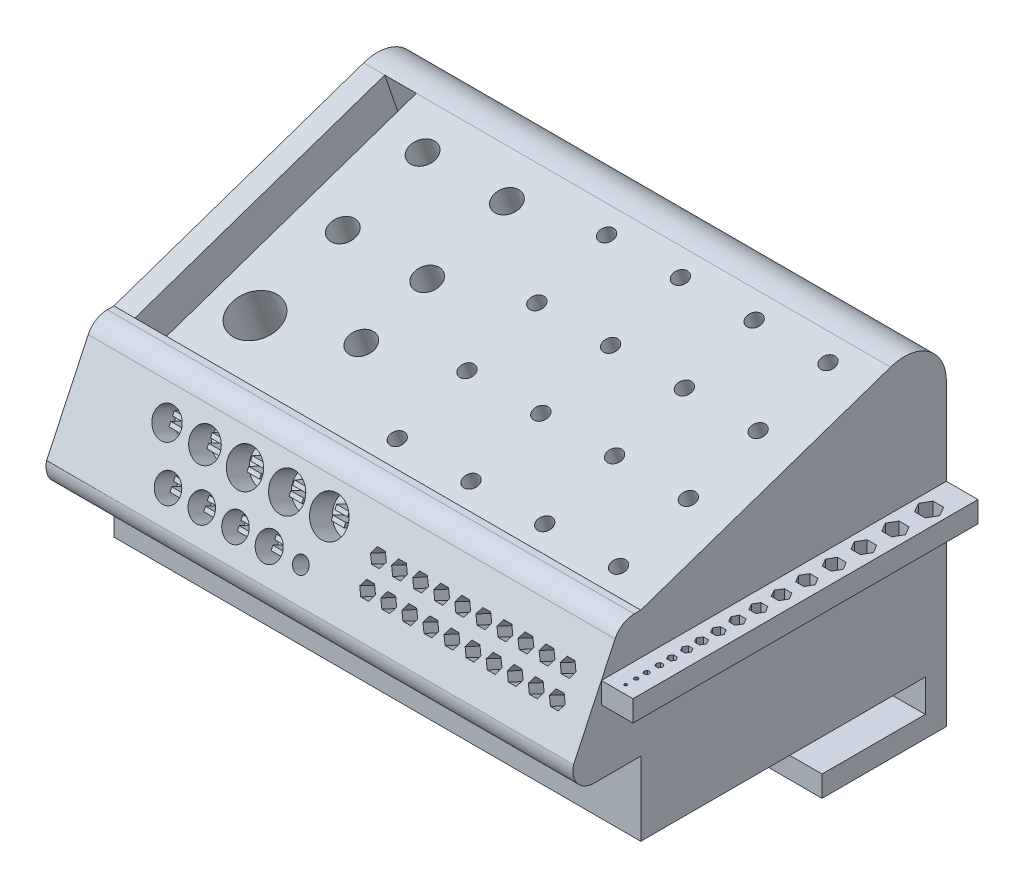
from build123d import *

# Parameters (mm, degrees)
BOSS_EXTRUDE1_DEPTH = 250
SKETCH2_R           = 3.5
CUT_EXTRUDE1_DEPTH  = 80
SKETCH3_R           = 6
SKETCH3_R_2         = 11
SKETCH3_W           = 15
SKETCH3_H           = 125.276618042
CUT_EXTRUDE3_DEPTH  = 80
SKETCH5_W           = 250
SKETCH5_H           = 60
BOSS_EXTRUDE3_DEPTH = 35
CUT_EXTRUDE4_DEPTH  = 339.389670995
CUT_EXTRUDE6_DEPTH  = 15
SKETCH9_R           = 8.625
SKETCH9_R_2         = 8.125
SKETCH9_R_3         = 7.125
SKETCH9_R_4         = 6.625
SKETCH9_R_5         = 6.125
SKETCH9_R_6         = 3.625
SKETCH9_R_7         = 6
CUT_EXTRUDE7_DEPTH  = 12
SKETCH10_W          = 6
SKETCH10_H          = 2
BOSS_EXTRUDE4_DEPTH = 6.25
SKETCH11_W          = 163.690314635
SKETCH11_H          = 10
BOSS_EXTRUDE5_DEPTH = 15
CUT_EXTRUDE8_DEPTH  = 330.146008669


with BuildPart() as part:
    # Sketch1 → Boss-Extrude1 (new body)
    with BuildSketch(Plane(origin=(0, 0, 0), x_dir=(0, 0, -1), z_dir=(1, 0, 0))):
        with BuildLine():
            Line((0, 0), (-49, 0))
            Line((-49, 0), (-49, -10))
            Line((-49, -10), (10, -10))
            Line((10, -10), (10, 132.011741113))
            ThreePointArc((10, 132.011741113), (1.627992291, 148.284104042), (-16.478979528, 150.933232182))
            Line((-16.478979528, 150.933232182), (-135, 110.35))
            Line((-135, 110.35), (-135, 15.35))
            Line((-135, 15.35), (0, 15.35))
            Line((0, 15.35), (0, 0))
        make_face()
    extrude(amount=BOSS_EXTRUDE1_DEPTH)

    # Sketch2 → Cut-Extrude1 (cut)
    with BuildSketch(Plane(origin=(0, 140.144330878, 47.987351918), x_dir=(1, 0, 0), z_dir=(0, 0.9460745534501107, 0.32394897640550396))):
        with Locations(Location((230, -81.972295169, 0), (0, 0, 270))):
            Circle(SKETCH2_R)
        with Locations(Location((230, -46.972295169, 0), (0, 0, 270))):
            Circle(SKETCH2_R)
        with Locations(Location((230, -11.972295169, 0), (0, 0, 270))):
            Circle(SKETCH2_R)
        with Locations(Location((230, 23.027704831, 0), (0, 0, 270))):
            Circle(SKETCH2_R)
        with Locations(Location((195, -81.972295169, 0), (0, 0, 270))):
            Circle(SKETCH2_R)
        with Locations(Location((195, -46.972295169, 0), (0, 0, 270))):
            Circle(SKETCH2_R)
        with Locations(Location((195, -11.972295169, 0), (0, 0, 270))):
            Circle(SKETCH2_R)
        with Locations(Location((195, 23.027704831, 0), (0, 0, 270))):
            Circle(SKETCH2_R)
        with Locations(Location((160, -81.972295169, 0), (0, 0, 270))):
            Circle(SKETCH2_R)
        with Locations(Location((160, -46.972295169, 0), (0, 0, 270))):
            Circle(SKETCH2_R)
        with Locations(Location((160, -11.972295169, 0), (0, 0, 270))):
            Circle(SKETCH2_R)
        with Locations(Location((160, 23.027704831, 0), (0, 0, 270))):
            Circle(SKETCH2_R)
        with Locations(Location((125, -81.972295169, 0), (0, 0, 270))):
            Circle(SKETCH2_R)
        with Locations(Location((125, -46.972295169, 0), (0, 0, 270))):
            Circle(SKETCH2_R)
        with Locations(Location((125, -11.972295169, 0), (0, 0, 270))):
            Circle(SKETCH2_R)
        with Locations(Location((125, 23.027704831, 0), (0, 0, 270))):
            Circle(SKETCH2_R)
    extrude(amount=-CUT_EXTRUDE1_DEPTH, mode=Mode.SUBTRACT)

    # Sketch3 → Cut-Extrude3 (cut)
    with BuildSketch(Plane(origin=(0, 140.144330878, 47.987351918), x_dir=(1, 0, 0), z_dir=(0, 0.9460745534501107, 0.32394897640550396))):
        with Locations(Location((85, 15.304322873, 0), (0, 0, 270))):
            Circle(SKETCH3_R)
        with Locations(Location((85, -24.695677127, 0), (0, 0, 270))):
            Circle(SKETCH3_R)
        with Locations(Location((85, -57.734559628, 0), (0, 0, 270))):
            Circle(SKETCH3_R)
        with Locations(Location((45, 15.304322873, 0), (0, 0, 270))):
            Circle(SKETCH3_R)
        with Locations(Location((45, -24.695677127, 0), (0, 0, 270))):
            Circle(SKETCH3_R)
        with Locations(Location((45, -68.745987147, 0), (0, 0, 270))):
            Circle(SKETCH3_R_2)
        with Locations((17.5, -29.333986148)):
            Rectangle(SKETCH3_W, SKETCH3_H)
    extrude(amount=-CUT_EXTRUDE3_DEPTH, mode=Mode.SUBTRACT)

    # Sketch5 → Boss-Extrude3 (add)
    with BuildSketch(Plane.XY.offset(135)):
        with Locations((125, 80.35)):
            Rectangle(SKETCH5_W, SKETCH5_H)
    extrude(amount=BOSS_EXTRUDE3_DEPTH)

    # Sketch6 → Cut-Extrude4 (cut, through all)
    with BuildSketch(Plane(origin=(250, 0, 0), x_dir=(0, 0, -1), z_dir=(1, 0, 0))):
        with BuildLine():
            Line((-170, 50.35), (-157.192235936, 50.35))
            ThreePointArc((-157.192235936, 50.35), (-165.074290316, 54.195877906), (-166.893660937, 62.77535625))
            Line((-166.893660937, 62.77535625), (-147.176252931, 104.613112241))
            ThreePointArc((-147.176252931, 104.613112241), (-143.486272945, 108.794854126), (-138.130487401, 110.35))
            Line((-138.130487401, 110.35), (-170, 110.35))
            Line((-170, 110.35), (-170, 50.35))
        make_face()
    extrude(amount=-CUT_EXTRUDE4_DEPTH, mode=Mode.SUBTRACT)

    # Sketch8 → Cut-Extrude6 (cut)
    with BuildSketch(Plane(origin=(0, 75.768264649, 160.770328793), x_dir=(1, 0, 0), z_dir=(0, 0.4263112240760583, 0.904576552994147))):
        Polygon((141.24722325, 14.765179927), (143.123611625, 11.515179927), (146.876388375, 11.515179927), (148.75277675, 14.765179927), (146.876388375, 18.015179927), (143.123611625, 18.015179927), align=None)
        Polygon((151.24722325, 14.765179927), (153.123611625, 11.515179927), (156.876388375, 11.515179927), (158.75277675, 14.765179927), (156.876388375, 18.015179927), (153.123611625, 18.015179927), align=None)
        Polygon((161.24722325, 14.765179927), (163.123611625, 11.515179927), (166.876388375, 11.515179927), (168.75277675, 14.765179927), (166.876388375, 18.015179927), (163.123611625, 18.015179927), align=None)
        Polygon((171.24722325, 14.765179927), (173.123611625, 11.515179927), (176.876388375, 11.515179927), (178.75277675, 14.765179927), (176.876388375, 18.015179927), (173.123611625, 18.015179927), align=None)
        Polygon((181.24722325, 14.765179927), (183.123611625, 11.515179927), (186.876388375, 11.515179927), (188.75277675, 14.765179927), (186.876388375, 18.015179927), (183.123611625, 18.015179927), align=None)
        Polygon((191.24722325, 14.765179927), (193.123611625, 11.515179927), (196.876388375, 11.515179927), (198.75277675, 14.765179927), (196.876388375, 18.015179927), (193.123611625, 18.015179927), align=None)
        Polygon((201.24722325, 14.765179927), (203.123611625, 11.515179927), (206.876388375, 11.515179927), (208.75277675, 14.765179927), (206.876388375, 18.015179927), (203.123611625, 18.015179927), align=None)
        Polygon((211.24722325, 14.765179927), (213.123611625, 11.515179927), (216.876388375, 11.515179927), (218.75277675, 14.765179927), (216.876388375, 18.015179927), (213.123611625, 18.015179927), align=None)
        Polygon((221.24722325, 14.765179927), (223.123611625, 11.515179927), (226.876388375, 11.515179927), (228.75277675, 14.765179927), (226.876388375, 18.015179927), (223.123611625, 18.015179927), align=None)
        Polygon((231.24722325, 14.765179927), (233.123611625, 11.515179927), (236.876388375, 11.515179927), (238.75277675, 14.765179927), (236.876388375, 18.015179927), (233.123611625, 18.015179927), align=None)
        Polygon((231.24722325, 2.765179927), (233.123611625, -0.484820073), (236.876388375, -0.484820073), (238.75277675, 2.765179927), (236.876388375, 6.015179927), (233.123611625, 6.015179927), align=None)
        Polygon((221.24722325, 2.765179927), (223.123611625, -0.484820073), (226.876388375, -0.484820073), (228.75277675, 2.765179927), (226.876388375, 6.015179927), (223.123611625, 6.015179927), align=None)
        Polygon((211.24722325, 2.765179927), (213.123611625, -0.484820073), (216.876388375, -0.484820073), (218.75277675, 2.765179927), (216.876388375, 6.015179927), (213.123611625, 6.015179927), align=None)
        Polygon((201.24722325, 2.765179927), (203.123611625, -0.484820073), (206.876388375, -0.484820073), (208.75277675, 2.765179927), (206.876388375, 6.015179927), (203.123611625, 6.015179927), align=None)
        Polygon((191.24722325, 2.765179927), (193.123611625, -0.484820073), (196.876388375, -0.484820073), (198.75277675, 2.765179927), (196.876388375, 6.015179927), (193.123611625, 6.015179927), align=None)
        Polygon((181.24722325, 2.765179927), (183.123611625, -0.484820073), (186.876388375, -0.484820073), (188.75277675, 2.765179927), (186.876388375, 6.015179927), (183.123611625, 6.015179927), align=None)
        Polygon((171.24722325, 2.765179927), (173.123611625, -0.484820073), (176.876388375, -0.484820073), (178.75277675, 2.765179927), (176.876388375, 6.015179927), (173.123611625, 6.015179927), align=None)
        Polygon((161.24722325, 2.765179927), (163.123611625, -0.484820073), (166.876388375, -0.484820073), (168.75277675, 2.765179927), (166.876388375, 6.015179927), (163.123611625, 6.015179927), align=None)
        Polygon((151.24722325, 2.765179927), (153.123611625, -0.484820073), (156.876388375, -0.484820073), (158.75277675, 2.765179927), (156.876388375, 6.015179927), (153.123611625, 6.015179927), align=None)
        Polygon((141.24722325, 2.765179927), (143.123611625, -0.484820073), (146.876388375, -0.484820073), (148.75277675, 2.765179927), (146.876388375, 6.015179927), (143.123611625, 6.015179927), align=None)
    extrude(amount=-CUT_EXTRUDE6_DEPTH, mode=Mode.SUBTRACT)

    # Sketch9 → Cut-Extrude7 (cut)
    with BuildSketch(Plane(origin=(0, 75.768264649, 160.770328793), x_dir=(1, 0, 0), z_dir=(0, 0.4263112240760583, 0.904576552994147))):
        with Locations(Location((120, 18.762077206, 0), (0, 0, 270))):
            Circle(SKETCH9_R)
        with Locations(Location((100, 18.762077206, 0), (0, 0, 270))):
            Circle(SKETCH9_R_2)
        with Locations(Location((80, 18.762077206, 0), (0, 0, 270))):
            Circle(SKETCH9_R_2)
        with Locations(Location((61, 18.762077206, 0), (0, 0, 270))):
            Circle(SKETCH9_R_3)
        with Locations(Location((43, 18.762077206, 0), (0, 0, 270))):
            Circle(SKETCH9_R_4)
        with Locations(Location((100, -1.237922794, 0), (0, 0, 270))):
            Circle(SKETCH9_R_5)
        with Locations(Location((115, -1.237922794, 0), (0, 0, 270))):
            Circle(SKETCH9_R_6)
        with Locations(Location((84, -1.237922794, 0), (0, 0, 270))):
            Circle(SKETCH9_R_7)
        with Locations(Location((68, -1.237922794, 0), (0, 0, 270))):
            Circle(SKETCH9_R_7)
        with Locations(Location((52, -1.237922794, 0), (0, 0, 270))):
            Circle(SKETCH9_R_7)
    extrude(amount=-CUT_EXTRUDE7_DEPTH, mode=Mode.SUBTRACT)

    # Sketch10 → Boss-Extrude4 (add)
    with BuildSketch(Plane(origin=(0, 70.65252996, 149.915410157), x_dir=(1, 0, 0), z_dir=(0, 0.4263112240760583, 0.904576552994147))):
        with Locations((100, 20.762077206)):
            Rectangle(SKETCH10_W, SKETCH10_H)
        with Locations((120, 20.762077206)):
            Rectangle(SKETCH10_W, SKETCH10_H)
        with Locations((120, 16.762077206)):
            Rectangle(SKETCH10_W, SKETCH10_H)
        with Locations((100, 16.762077206)):
            Rectangle(SKETCH10_W, SKETCH10_H)
        with Locations((80, 20.762077206)):
            Rectangle(SKETCH10_W, SKETCH10_H)
        with Locations((80, 16.762077206)):
            Rectangle(SKETCH10_W, SKETCH10_H)
        with Locations((61.000897675, 20.762077206)):
            Rectangle(SKETCH10_W, SKETCH10_H)
        with Locations((61, 16.762077206)):
            Rectangle(SKETCH10_W, SKETCH10_H)
        with Locations((43, 20.762077206)):
            Rectangle(SKETCH10_W, SKETCH10_H)
        with Locations((43, 16.762077206)):
            Rectangle(SKETCH10_W, SKETCH10_H)
        with Locations((52, 0.762077206)):
            Rectangle(SKETCH10_W, SKETCH10_H)
        with Locations((52, -3.237922794)):
            Rectangle(SKETCH10_W, SKETCH10_H)
        with Locations((68, 0.762077206)):
            Rectangle(SKETCH10_W, SKETCH10_H)
        with Locations((68, -3.237922794)):
            Rectangle(SKETCH10_W, SKETCH10_H)
        with Locations((84, 0.762077206)):
            Rectangle(SKETCH10_W, SKETCH10_H)
        with Locations((84, -3.237922794)):
            Rectangle(SKETCH10_W, SKETCH10_H)
        with Locations((100, 0.762077206)):
            Rectangle(SKETCH10_W, SKETCH10_H)
        with Locations((100, -3.237922794)):
            Rectangle(SKETCH10_W, SKETCH10_H)
    extrude(amount=BOSS_EXTRUDE4_DEPTH)

    # Sketch11 → Boss-Extrude5 (add)
    with BuildSketch(Plane(origin=(250, 0, 0), x_dir=(0, 0, -1), z_dir=(1, 0, 0))):
        with Locations((-71.845157318, 85.791126918)):
            Rectangle(SKETCH11_W, SKETCH11_H)
    extrude(amount=BOSS_EXTRUDE5_DEPTH)

    # Sketch12 → Cut-Extrude8 (cut, through all)
    with BuildSketch(Plane(origin=(0, 90.791126918, 0), x_dir=(1, 0, 0), z_dir=(0, 1, 0))):
        Polygon((258.221687836, -149.690314635), (257.860843918, -149.065314635), (257.139156082, -149.065314635), (256.778312164, -149.690314635), (257.139156082, -150.315314635), (257.860843918, -150.315314635), align=None)
        Polygon((258.510362971, -144.690314635), (258.005181486, -143.815314635), (256.994818514, -143.815314635), (256.489637029, -144.690314635), (256.994818514, -145.565314635), (258.005181486, -145.565314635), align=None)
        Polygon((258.799038106, -139.690314635), (258.149519053, -138.565314635), (256.850480947, -138.565314635), (256.200961894, -139.690314635), (256.850480947, -140.815314635), (258.149519053, -140.815314635), align=None)
        Polygon((259.08771324, -133.690314635), (258.29385662, -132.315314635), (256.70614338, -132.315314635), (255.91228676, -133.690314635), (256.70614338, -135.065314635), (258.29385662, -135.065314635), align=None)
        Polygon((259.376388375, -127.690314635), (258.438194187, -126.065314635), (256.561805813, -126.065314635), (255.623611625, -127.690314635), (256.561805813, -129.315314635), (258.438194187, -129.315314635), align=None)
        Polygon((259.665063509, -120.690314635), (258.582531755, -118.815314635), (256.417468245, -118.815314635), (255.334936491, -120.690314635), (256.417468245, -122.565314635), (258.582531755, -122.565314635), align=None)
        Polygon((259.953738644, -113.690314635), (258.726869322, -111.565314635), (256.273130678, -111.565314635), (255.046261356, -113.690314635), (256.273130678, -115.815314635), (258.726869322, -115.815314635), align=None)
        Polygon((260.242413779, -105.690314635), (258.871206889, -103.315314635), (256.128793111, -103.315314635), (254.757586221, -105.690314635), (256.128793111, -108.065314635), (258.871206889, -108.065314635), align=None)
        Polygon((260.531088913, -96.690314635), (259.015544457, -94.065314635), (255.984455543, -94.065314635), (254.468911087, -96.690314635), (255.984455543, -99.315314635), (259.015544457, -99.315314635), align=None)
        Polygon((260.819764048, -86.690314635), (259.159882024, -83.815314635), (255.840117976, -83.815314635), (254.180235952, -86.690314635), (255.840117976, -89.565314635), (259.159882024, -89.565314635), align=None)
        Polygon((261.108439182, -75.690314635), (259.304219591, -72.565314635), (255.695780409, -72.565314635), (253.891560818, -75.690314635), (255.695780409, -78.815314635), (259.304219591, -78.815314635), align=None)
        Polygon((261.397114317, -63.690314635), (259.448557159, -60.315314635), (255.551442841, -60.315314635), (253.602885683, -63.690314635), (255.551442841, -67.065314635), (259.448557159, -67.065314635), align=None)
        Polygon((261.685789452, -50.690314635), (259.592894726, -47.065314635), (255.407105274, -47.065314635), (253.314210548, -50.690314635), (255.407105274, -54.315314635), (259.592894726, -54.315314635), align=None)
        Polygon((261.974464586, -36.690314635), (259.737232293, -32.815314635), (255.262767707, -32.815314635), (253.025535414, -36.690314635), (255.262767707, -40.565314635), (259.737232293, -40.565314635), align=None)
        Polygon((252.736860279, -21.690314635), (255.11843014, -25.815314635), (259.88156986, -25.815314635), (262.263139721, -21.690314635), (259.88156986, -17.565314635), (255.11843014, -17.565314635), align=None)
        Polygon((252.448185145, -5.690314635), (254.974092572, -10.065314635), (260.025907428, -10.065314635), (262.551814855, -5.690314635), (260.025907428, -1.315314635), (254.974092572, -1.315314635), align=None)
    extrude(amount=-CUT_EXTRUDE8_DEPTH, mode=Mode.SUBTRACT)


solid = part.part
